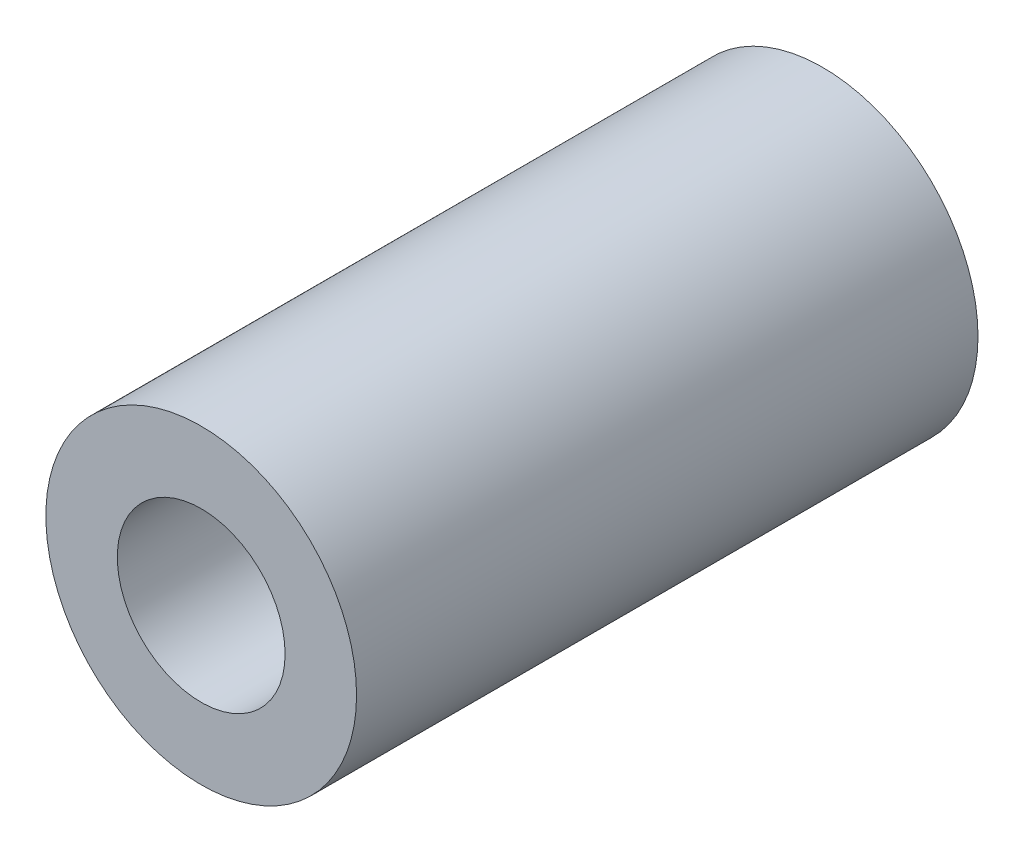
from build123d import *

# Parameters (mm, degrees)
SKETCH1_R           = 2.5
SKETCH1_R_2         = 1.35
BOSS_EXTRUDE1_DEPTH = 10


with BuildPart() as part:
    # Sketch1 → Boss-Extrude1 (new body)
    with BuildSketch(Plane.XY):
        Circle(SKETCH1_R)
        Circle(SKETCH1_R_2, mode=Mode.SUBTRACT)
    extrude(amount=BOSS_EXTRUDE1_DEPTH)


solid = part.part
